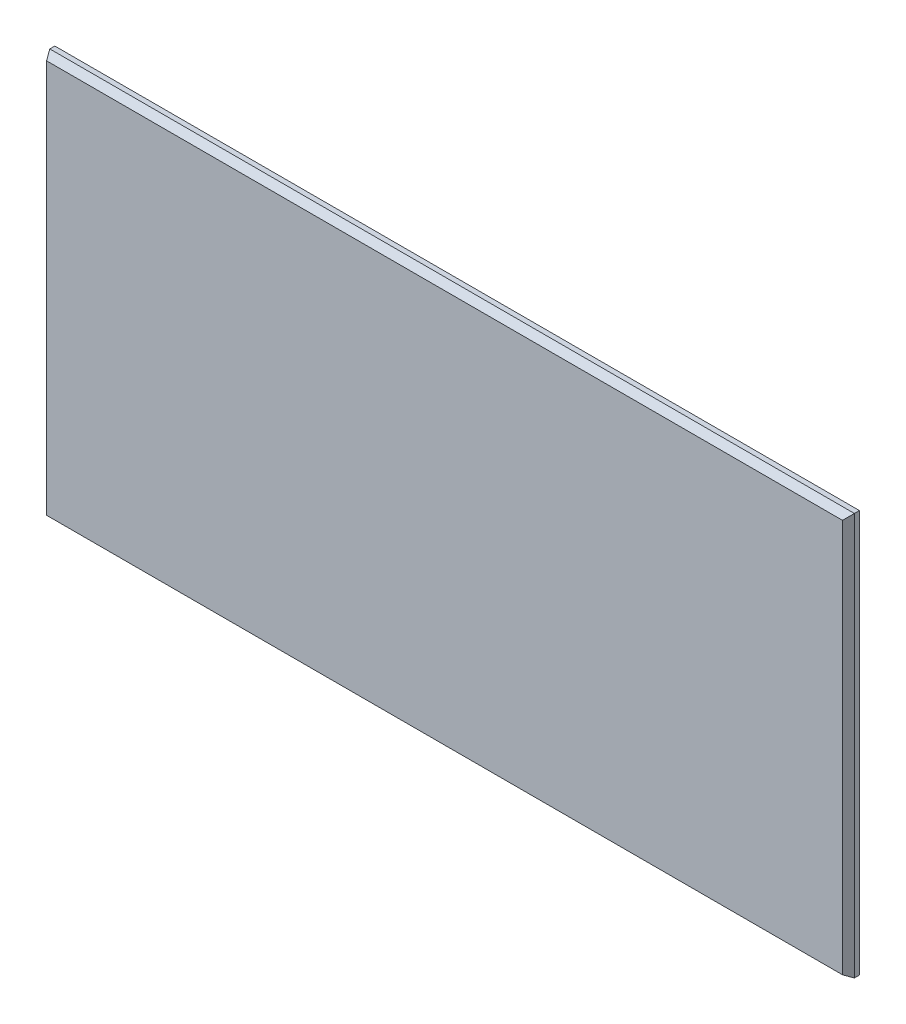
from build123d import *

# Parameters (mm, degrees)
SKETCH3_W           = 101.6
SKETCH3_H           = 50.8
BOSS_EXTRUDE1_DEPTH = 0.635
SKETCH4_W           = 101.6
SKETCH4_H           = 50.8
BOSS_EXTRUDE2_DEPTH = 0.9525
BOSS_EXTRUDE2_TAPER = 30


with BuildPart() as part:
    # Sketch3 → Boss-Extrude1 (new body)
    with BuildSketch(Plane.XY.offset(-0.79375)):
        Rectangle(SKETCH3_W, SKETCH3_H)
    extrude(amount=BOSS_EXTRUDE1_DEPTH)

    # Sketch4 → Boss-Extrude2 (add)
    with BuildSketch(Plane.XY.offset(-0.15875)):
        Rectangle(SKETCH4_W, SKETCH4_H)
    extrude(amount=BOSS_EXTRUDE2_DEPTH, taper=BOSS_EXTRUDE2_TAPER)


solid = part.part
